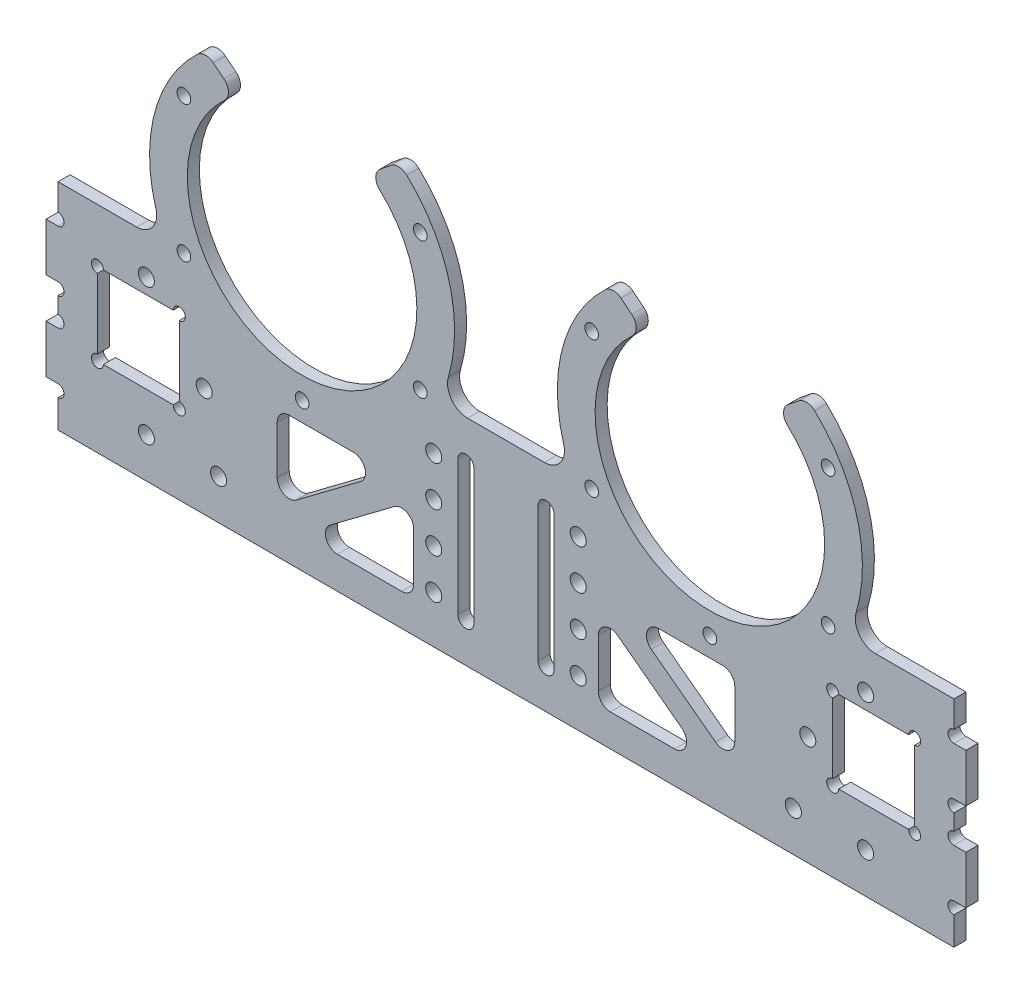
from build123d import *

# Parameters (mm, degrees)
SKETCH_1_W          = 203.2
SKETCH_1_H          = 121.6
EXTRUDE_1_DEPTH     = 3
CUT_EXTRUDE_1_REACH = 120.441
SKETCH_5_R          = 20.75
SKETCH_5_R_2        = 1.7
CUT_EXTRUDE_2_REACH = 120.441
SKETCH_6_R          = 20.75
SKETCH_6_R_2        = 1.7
SKETCH_7_W          = 3
SKETCH_7_H          = 53.589820792
EXTRUDE_2_DEPTH     = 13
SKETCH_9_W          = 3
SKETCH_9_H          = 53.589820792
EXTRUDE_3_DEPTH     = 13
SKETCH_12_W         = 20.4
SKETCH_12_H         = 20.4
CUT_EXTRUDE_6_DEPTH = 130.764401898
SKETCH_13_R         = 2
CUT_EXTRUDE_7_DEPTH = 130.764401898
SKETCH_14_R         = 2
CUT_EXTRUDE_8_DEPTH = 130.764401898
FILLET_1_R          = 3
CUT_EXTRUDE_9_DEPTH = 130.764401898


with BuildPart() as part:
    # 草图1 → 凸台-拉伸1 (new body)
    with BuildSketch(Plane.XY):
        Rectangle(SKETCH_1_W, SKETCH_1_H)
    extrude(amount=-EXTRUDE_1_DEPTH)

    # 草图5 → 切除-拉伸1 (cut, up to next)
    with BuildSketch(Plane.XY, mode=Mode.PRIVATE) as cut_extrude_1_sk1:
        with Locations((-50.8, 10)):
            Circle(SKETCH_5_R)
    cut_extrude_1_tool1 = extrude(cut_extrude_1_sk1.sketch, amount=-CUT_EXTRUDE_1_REACH, mode=Mode.PRIVATE) & part.part
    # 草图5 → 切除-拉伸1 (cut, up to next)
    with BuildSketch(Plane.XY, mode=Mode.PRIVATE) as cut_extrude_1_sk2:
        with Locations((50.8, 10)):
            Circle(SKETCH_5_R)
    cut_extrude_1_tool2 = extrude(cut_extrude_1_sk2.sketch, amount=-CUT_EXTRUDE_1_REACH, mode=Mode.PRIVATE) & part.part
    # 草图5 → 切除-拉伸1 (cut, up to next)
    with BuildSketch(Plane.XY, mode=Mode.PRIVATE) as cut_extrude_1_sk3:
        with Locations((-50.8, 44)):
            Circle(SKETCH_5_R_2)
    cut_extrude_1_tool3 = extrude(cut_extrude_1_sk3.sketch, amount=-CUT_EXTRUDE_1_REACH, mode=Mode.PRIVATE) & part.part
    # 草图5 → 切除-拉伸1 (cut, up to next)
    with BuildSketch(Plane.XY, mode=Mode.PRIVATE) as cut_extrude_1_sk4:
        with Locations((-21.355136271, 27)):
            Circle(SKETCH_5_R_2)
    cut_extrude_1_tool4 = extrude(cut_extrude_1_sk4.sketch, amount=-CUT_EXTRUDE_1_REACH, mode=Mode.PRIVATE) & part.part
    # 草图5 → 切除-拉伸1 (cut, up to next)
    with BuildSketch(Plane.XY, mode=Mode.PRIVATE) as cut_extrude_1_sk5:
        with Locations((-21.355136271, -7)):
            Circle(SKETCH_5_R_2)
    cut_extrude_1_tool5 = extrude(cut_extrude_1_sk5.sketch, amount=-CUT_EXTRUDE_1_REACH, mode=Mode.PRIVATE) & part.part
    # 草图5 → 切除-拉伸1 (cut, up to next)
    with BuildSketch(Plane.XY, mode=Mode.PRIVATE) as cut_extrude_1_sk6:
        with Locations((-50.8, -24)):
            Circle(SKETCH_5_R_2)
    cut_extrude_1_tool6 = extrude(cut_extrude_1_sk6.sketch, amount=-CUT_EXTRUDE_1_REACH, mode=Mode.PRIVATE) & part.part
    # 草图5 → 切除-拉伸1 (cut, up to next)
    with BuildSketch(Plane.XY, mode=Mode.PRIVATE) as cut_extrude_1_sk7:
        with Locations((-80.244863729, -7)):
            Circle(SKETCH_5_R_2)
    cut_extrude_1_tool7 = extrude(cut_extrude_1_sk7.sketch, amount=-CUT_EXTRUDE_1_REACH, mode=Mode.PRIVATE) & part.part
    # 草图5 → 切除-拉伸1 (cut, up to next)
    with BuildSketch(Plane.XY, mode=Mode.PRIVATE) as cut_extrude_1_sk8:
        with Locations((-80.244863729, 27)):
            Circle(SKETCH_5_R_2)
    cut_extrude_1_tool8 = extrude(cut_extrude_1_sk8.sketch, amount=-CUT_EXTRUDE_1_REACH, mode=Mode.PRIVATE) & part.part
    # 草图5 → 切除-拉伸1 (cut, up to next)
    with BuildSketch(Plane.XY, mode=Mode.PRIVATE) as cut_extrude_1_sk9:
        with Locations((50.8, 44)):
            Circle(SKETCH_5_R_2)
    cut_extrude_1_tool9 = extrude(cut_extrude_1_sk9.sketch, amount=-CUT_EXTRUDE_1_REACH, mode=Mode.PRIVATE) & part.part
    # 草图5 → 切除-拉伸1 (cut, up to next)
    with BuildSketch(Plane.XY, mode=Mode.PRIVATE) as cut_extrude_1_sk10:
        with Locations((80.244863729, 27)):
            Circle(SKETCH_5_R_2)
    cut_extrude_1_tool10 = extrude(cut_extrude_1_sk10.sketch, amount=-CUT_EXTRUDE_1_REACH, mode=Mode.PRIVATE) & part.part
    # 草图5 → 切除-拉伸1 (cut, up to next)
    with BuildSketch(Plane.XY, mode=Mode.PRIVATE) as cut_extrude_1_sk11:
        with Locations((80.244863729, -7)):
            Circle(SKETCH_5_R_2)
    cut_extrude_1_tool11 = extrude(cut_extrude_1_sk11.sketch, amount=-CUT_EXTRUDE_1_REACH, mode=Mode.PRIVATE) & part.part
    # 草图5 → 切除-拉伸1 (cut, up to next)
    with BuildSketch(Plane.XY, mode=Mode.PRIVATE) as cut_extrude_1_sk12:
        with Locations((50.8, -24)):
            Circle(SKETCH_5_R_2)
    cut_extrude_1_tool12 = extrude(cut_extrude_1_sk12.sketch, amount=-CUT_EXTRUDE_1_REACH, mode=Mode.PRIVATE) & part.part
    # 草图5 → 切除-拉伸1 (cut, up to next)
    with BuildSketch(Plane.XY, mode=Mode.PRIVATE) as cut_extrude_1_sk13:
        with Locations((21.355136271, -7)):
            Circle(SKETCH_5_R_2)
    cut_extrude_1_tool13 = extrude(cut_extrude_1_sk13.sketch, amount=-CUT_EXTRUDE_1_REACH, mode=Mode.PRIVATE) & part.part
    # 草图5 → 切除-拉伸1 (cut, up to next)
    with BuildSketch(Plane.XY, mode=Mode.PRIVATE) as cut_extrude_1_sk14:
        with Locations((21.355136271, 27)):
            Circle(SKETCH_5_R_2)
    cut_extrude_1_tool14 = extrude(cut_extrude_1_sk14.sketch, amount=-CUT_EXTRUDE_1_REACH, mode=Mode.PRIVATE) & part.part
    add(cut_extrude_1_tool1.solids().sort_by_distance((-50.8, 10, 0))[0], mode=Mode.SUBTRACT)
    add(cut_extrude_1_tool2.solids().sort_by_distance((50.8, 10, 0))[0], mode=Mode.SUBTRACT)
    add(cut_extrude_1_tool3.solids().sort_by_distance((-50.8, 44, 0))[0], mode=Mode.SUBTRACT)
    add(cut_extrude_1_tool4.solids().sort_by_distance((-21.355136, 27, 0))[0], mode=Mode.SUBTRACT)
    add(cut_extrude_1_tool5.solids().sort_by_distance((-21.355136, -7, 0))[0], mode=Mode.SUBTRACT)
    add(cut_extrude_1_tool6.solids().sort_by_distance((-50.8, -24, 0))[0], mode=Mode.SUBTRACT)
    add(cut_extrude_1_tool7.solids().sort_by_distance((-80.244864, -7, 0))[0], mode=Mode.SUBTRACT)
    add(cut_extrude_1_tool8.solids().sort_by_distance((-80.244864, 27, 0))[0], mode=Mode.SUBTRACT)
    add(cut_extrude_1_tool9.solids().sort_by_distance((50.8, 44, 0))[0], mode=Mode.SUBTRACT)
    add(cut_extrude_1_tool10.solids().sort_by_distance((80.244864, 27, 0))[0], mode=Mode.SUBTRACT)
    add(cut_extrude_1_tool11.solids().sort_by_distance((80.244864, -7, 0))[0], mode=Mode.SUBTRACT)
    add(cut_extrude_1_tool12.solids().sort_by_distance((50.8, -24, 0))[0], mode=Mode.SUBTRACT)
    add(cut_extrude_1_tool13.solids().sort_by_distance((21.355136, -7, 0))[0], mode=Mode.SUBTRACT)
    add(cut_extrude_1_tool14.solids().sort_by_distance((21.355136, 27, 0))[0], mode=Mode.SUBTRACT)

    # 草图6 → 切除-拉伸2 (cut, up to next)
    with BuildSketch(Plane(origin=(0, 0, -3), x_dir=(-1, 0, 0), z_dir=(0, 0, -1)), mode=Mode.PRIVATE) as cut_extrude_2_sk1:
        with BuildLine():
            Line((-101.6, 60.8), (-101.6, -7.210179208))
            Line((-101.6, -7.210179208), (-92.029983309, -7.210179208))
            ThreePointArc((-92.029983309, -7.210179208), (-88.023804245, -5.20192273), (-87.235799204, -0.790390928))
            ThreePointArc((-87.235799204, -0.790390928), (-87.128613522, 21.145933769), (-74.914896502, 39.367869632))
            Line((-74.914896502, 39.367869632), (-67.371748679, 33.309593427))
            ThreePointArc((-67.371748679, 33.309593427), (-50.8, -18.6), (-34.228251321, 33.309593427))
            Line((-34.228251321, 33.309593427), (-26.685103498, 39.367869632))
            ThreePointArc((-26.685103498, 39.367869632), (-14.471386478, 21.145933769), (-14.364200796, -0.790390928))
            ThreePointArc((-14.364200796, -0.790390928), (-13.576195755, -5.20192273), (-9.570016691, -7.210179208))
            Line((-9.570016691, -7.210179208), (9.570016691, -7.210179208))
            ThreePointArc((9.570016691, -7.210179208), (13.576195755, -5.20192273), (14.364200796, -0.790390928))
            ThreePointArc((14.364200796, -0.790390928), (14.471386478, 21.145933769), (26.685103498, 39.367869632))
            Line((26.685103498, 39.367869632), (34.228251321, 33.309593427))
            ThreePointArc((34.228251321, 33.309593427), (50.8, -18.6), (67.371748679, 33.309593427))
            Line((67.371748679, 33.309593427), (74.914896502, 39.367869632))
            ThreePointArc((74.914896502, 39.367869632), (87.128613522, 21.145933769), (87.235799204, -0.790390928))
            ThreePointArc((87.235799204, -0.790390928), (88.023804245, -5.20192273), (92.029983309, -7.210179208))
            Line((92.029983309, -7.210179208), (101.6, -7.210179208))
            Line((101.6, -7.210179208), (101.6, 60.8))
            Line((101.6, 60.8), (-101.6, 60.8))
        make_face()
        with Locations((50.8, 10)):
            Circle(SKETCH_6_R, mode=Mode.SUBTRACT)
        with Locations((-50.8, 10)):
            Circle(SKETCH_6_R, mode=Mode.SUBTRACT)
        with Locations((-50.8, 44)):
            Circle(SKETCH_6_R_2, mode=Mode.SUBTRACT)
        with Locations((50.8, 44)):
            Circle(SKETCH_6_R_2, mode=Mode.SUBTRACT)
    cut_extrude_2_tool1 = extrude(cut_extrude_2_sk1.sketch, amount=-CUT_EXTRUDE_2_REACH, mode=Mode.PRIVATE) & part.part
    add(cut_extrude_2_tool1.solids().sort_by_distance((0, 30.704944, -3))[0], mode=Mode.SUBTRACT)

    # 草图7 → 凸台-拉伸2 (add)
    with BuildSketch(Plane(origin=(101.6, 0, 0), x_dir=(0, 0, -1), z_dir=(1, 0, 0))):
        with Locations((1.5, -34.005089604)):
            Rectangle(SKETCH_7_W, SKETCH_7_H)
    extrude(amount=EXTRUDE_2_DEPTH)

    # 草图9 → 凸台-拉伸3 (add)
    with BuildSketch(Plane.ZY.offset(101.6)):
        with Locations((-1.5, -34.005089604)):
            Rectangle(SKETCH_9_W, SKETCH_9_H)
    extrude(amount=EXTRUDE_3_DEPTH)

    # 草图12 → 切除-拉伸6 (cut, through all)
    with BuildSketch(Plane(origin=(0, 0, -3), x_dir=(-1, 0, 0), z_dir=(0, 0, -1))):
        with Locations((-91.6, -30.8)):
            Rectangle(SKETCH_12_W, SKETCH_12_H)
        with BuildLine():
            Line((-101.8, -22.1), (-101.8, -20.6))
            Line((-101.8, -20.6), (-100.3, -20.6))
            ThreePointArc((-100.3, -20.6), (-102.860660172, -19.539339828), (-101.8, -22.1))
        make_face()
        with BuildLine():
            Line((-101.8, -41), (-101.8, -39.5))
            ThreePointArc((-101.8, -39.5), (-102.860660172, -42.060660172), (-100.3, -41))
            Line((-100.3, -41), (-101.8, -41))
        make_face()
        with BuildLine():
            Line((-81.4, -41), (-82.9, -41))
            ThreePointArc((-82.9, -41), (-80.339339828, -42.060660172), (-81.4, -39.5))
            Line((-81.4, -39.5), (-81.4, -41))
        make_face()
        with BuildLine():
            ThreePointArc((-81.4, -22.1), (-80.339339828, -19.539339828), (-82.9, -20.6))
            Line((-82.9, -20.6), (-81.4, -20.6))
            Line((-81.4, -20.6), (-81.4, -22.1))
        make_face()
        with BuildLine():
            Line((81.4, -22.1), (81.4, -20.6))
            Line((81.4, -20.6), (82.9, -20.6))
            ThreePointArc((82.9, -20.6), (80.339339828, -19.539339828), (81.4, -22.1))
        make_face()
        with BuildLine():
            ThreePointArc((101.8, -22.1), (102.860660172, -19.539339828), (100.3, -20.6))
            Line((100.3, -20.6), (101.8, -20.6))
            Line((101.8, -20.6), (101.8, -22.1))
        make_face()
        with BuildLine():
            Line((101.8, -41), (100.3, -41))
            ThreePointArc((100.3, -41), (102.860660172, -42.060660172), (101.8, -39.5))
            Line((101.8, -39.5), (101.8, -41))
        make_face()
        with Locations((91.6, -30.8)):
            Rectangle(SKETCH_12_W, SKETCH_12_H)
        with BuildLine():
            Line((81.4, -41), (81.4, -39.5))
            ThreePointArc((81.4, -39.5), (80.339339828, -42.060660172), (82.9, -41))
            Line((82.9, -41), (81.4, -41))
        make_face()
    extrude(amount=-CUT_EXTRUDE_6_DEPTH, mode=Mode.SUBTRACT)

    # 草图13 → 切除-拉伸7 (cut, through all)
    with BuildSketch(Plane(origin=(0, 0, -3), x_dir=(-1, 0, 0), z_dir=(0, 0, -1))):
        with Locations((89.6, -50.8)):
            Circle(SKETCH_13_R)
        with Locations((-89.6, -50.8)):
            Circle(SKETCH_13_R)
        with Locations((71.6, -50.8)):
            Circle(SKETCH_13_R)
        with Locations((75.189185504, -33.621628993)):
            Circle(SKETCH_13_R)
        with Locations((89.6, -16.8)):
            Circle(SKETCH_13_R)
        with Locations((-71.6, -50.8)):
            Circle(SKETCH_13_R)
        with Locations((-89.6, -16.8)):
            Circle(SKETCH_13_R)
        with Locations((-75.189185504, -33.621628993)):
            Circle(SKETCH_13_R)
    extrude(amount=-CUT_EXTRUDE_7_DEPTH, mode=Mode.SUBTRACT)

    # 草图14 → 切除-拉伸8 (cut, through all)
    with BuildSketch(Plane.XY):
        with Locations((18, -19.005089604)):
            Circle(SKETCH_14_R)
        with Locations((18, -29.005089604)):
            Circle(SKETCH_14_R)
        with Locations((18, -39.005089604)):
            Circle(SKETCH_14_R)
        with Locations((18, -49.005089604)):
            Circle(SKETCH_14_R)
        with Locations(Location((-18, -49.005089604, 0), (0, 0, 180))):
            Circle(SKETCH_14_R)
        with Locations(Location((-18, -39.005089604, 0), (0, 0, 180))):
            Circle(SKETCH_14_R)
        with Locations(Location((-18, -29.005089604, 0), (0, 0, 180))):
            Circle(SKETCH_14_R)
        with Locations(Location((-18, -19.005089604, 0), (0, 0, 180))):
            Circle(SKETCH_14_R)
        with BuildLine():
            Line((-8, -17.210179208), (-8, -50.8))
            ThreePointArc((-8, -50.8), (-10, -52.8), (-12, -50.8))
            Line((-12, -50.8), (-12, -17.210179208))
            ThreePointArc((-12, -17.210179208), (-10, -15.210179208), (-8, -17.210179208))
        make_face()
        with BuildLine():
            Line((8, -17.210179208), (8, -50.8))
            ThreePointArc((8, -50.8), (10, -52.8), (12, -50.8))
            Line((12, -50.8), (12, -17.210179208))
            ThreePointArc((12, -17.210179208), (10, -15.210179208), (8, -17.210179208))
        make_face()
        Polygon((23, -52.8), (51, -52.8), (23, -31.8), align=None)
        Polygon((57, -49.8), (57, -28.8), (29, -28.8), align=None)
        Polygon((-23, -52.8), (-23, -31.8), (-51, -52.8), align=None)
        Polygon((-29, -28.8), (-57, -49.8), (-57, -28.8), align=None)
    extrude(amount=-CUT_EXTRUDE_8_DEPTH, mode=Mode.SUBTRACT)

    # 圆角1
    fillet_1_edges = [part.edges().sort_by_distance(p)[0] for p in [
        (-67.371748679, 33.309593427, -1.5),
        (34.228251321, 33.309593427, -1.5),
        (-23, -52.8, -1.5),
        (-51, -52.8, -1.5),
        (-23, -31.8, -1.5),
        (23, -52.8, -1.5),
        (23, -31.8, -1.5),
        (51, -52.8, -1.5),
        (57, -49.8, -1.5),
        (29, -28.8, -1.5),
        (57, -28.8, -1.5),
        (-57, -49.8, -1.5),
        (-57, -28.8, -1.5),
        (-29, -28.8, -1.5),
        (74.914896502, 39.367869632, -1.5),
        (67.371748679, 33.309593427, -1.5),
        (26.685103498, 39.367869632, -1.5),
        (-26.685103498, 39.367869632, -1.5),
        (-34.228251321, 33.309593427, -1.5),
        (-74.914896502, 39.367869632, -1.5),
    ]]
    fillet(fillet_1_edges, radius=FILLET_1_R)

    # 草图15 → 切除-拉伸9 (cut, through all)
    with BuildSketch(Plane.XY):
        with BuildLine():
            Line((-114.6, -38.8), (-111.6, -38.8))
            ThreePointArc((-111.6, -38.8), (-110.1, -37.3), (-111.6, -35.8))
            Line((-111.6, -35.8), (-111.6, -31.8))
            ThreePointArc((-111.6, -31.8), (-110.1, -30.3), (-111.6, -28.8))
            Line((-111.6, -28.8), (-114.6, -28.8))
            Line((-114.6, -28.8), (-114.6, -38.8))
        make_face()
        with BuildLine():
            Line((-114.6, -60.8), (-111.6, -60.8))
            Line((-111.6, -60.8), (-111.6, -53.8))
            ThreePointArc((-111.6, -53.8), (-110.1, -52.3), (-111.6, -50.8))
            Line((-111.6, -50.8), (-114.6, -50.8))
            Line((-114.6, -50.8), (-114.6, -60.8))
        make_face()
        with BuildLine():
            Line((-114.6, -7.210179208), (-111.6, -7.210179208))
            Line((-111.6, -7.210179208), (-111.6, -13.8))
            ThreePointArc((-111.6, -13.8), (-110.1, -15.3), (-111.6, -16.8))
            Line((-111.6, -16.8), (-114.6, -16.8))
            Line((-114.6, -16.8), (-114.6, -7.210179208))
        make_face()
        with BuildLine():
            Line((111.6, -60.8), (111.6, -53.8))
            ThreePointArc((111.6, -53.8), (110.1, -52.3), (111.6, -50.8))
            Line((111.6, -50.8), (114.6, -50.8))
            Line((114.6, -50.8), (114.6, -60.8))
            Line((114.6, -60.8), (111.6, -60.8))
        make_face()
        with BuildLine():
            Line((111.6, -35.8), (111.6, -31.8))
            ThreePointArc((111.6, -31.8), (110.1, -30.3), (111.6, -28.8))
            Line((111.6, -28.8), (114.6, -28.8))
            Line((114.6, -28.8), (114.6, -38.8))
            Line((114.6, -38.8), (111.6, -38.8))
            ThreePointArc((111.6, -38.8), (110.1, -37.3), (111.6, -35.8))
        make_face()
        with BuildLine():
            Line((114.6, -16.8), (111.6, -16.8))
            ThreePointArc((111.6, -16.8), (110.1, -15.3), (111.6, -13.8))
            Line((111.6, -13.8), (111.6, -7.210179208))
            Line((111.6, -7.210179208), (114.6, -7.210179208))
            Line((114.6, -7.210179208), (114.6, -16.8))
        make_face()
    extrude(amount=-CUT_EXTRUDE_9_DEPTH, mode=Mode.SUBTRACT)


solid = part.part
